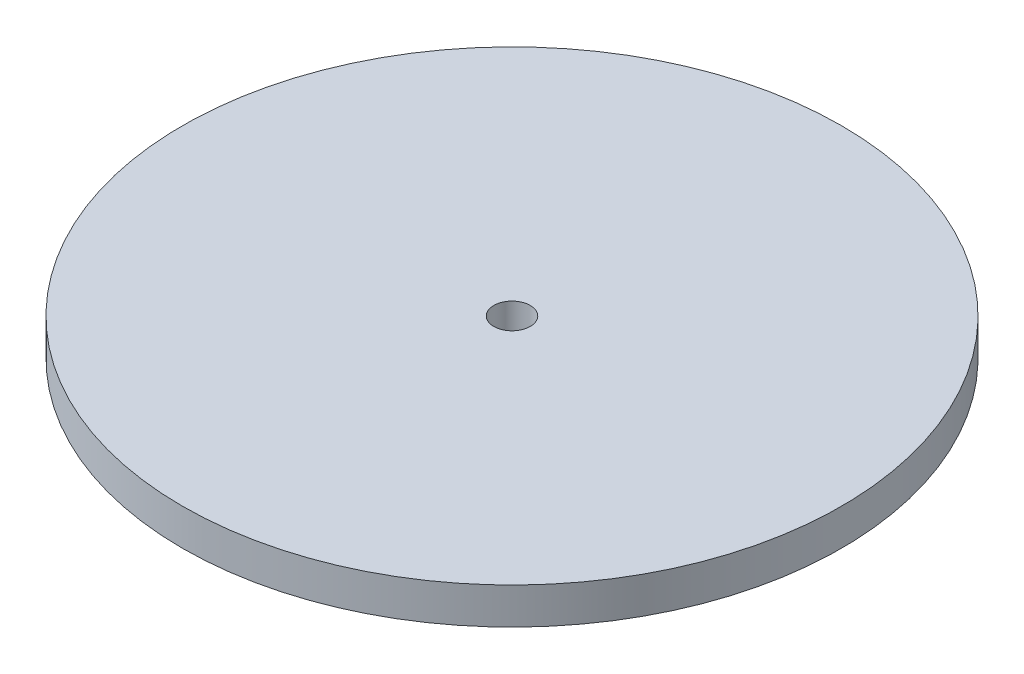
from build123d import *

# Parameters (mm, degrees)
SKETCH1_R           = 36.15
SKETCH1_R_2         = 2
BOSS_EXTRUDE1_DEPTH = 4


with BuildPart() as part:
    # Sketch1 → Boss-Extrude1 (new body)
    with BuildSketch(Plane(origin=(0, 0, 0), x_dir=(1, 0, 0), z_dir=(0, 1, 0))):
        with Locations(Location((0, 0, 0), (0, 0, 270))):
            Circle(SKETCH1_R)
        with Locations(Location((0, 0, 0), (0, 0, 270))):
            Circle(SKETCH1_R_2, mode=Mode.SUBTRACT)
    extrude(amount=BOSS_EXTRUDE1_DEPTH)


solid = part.part
